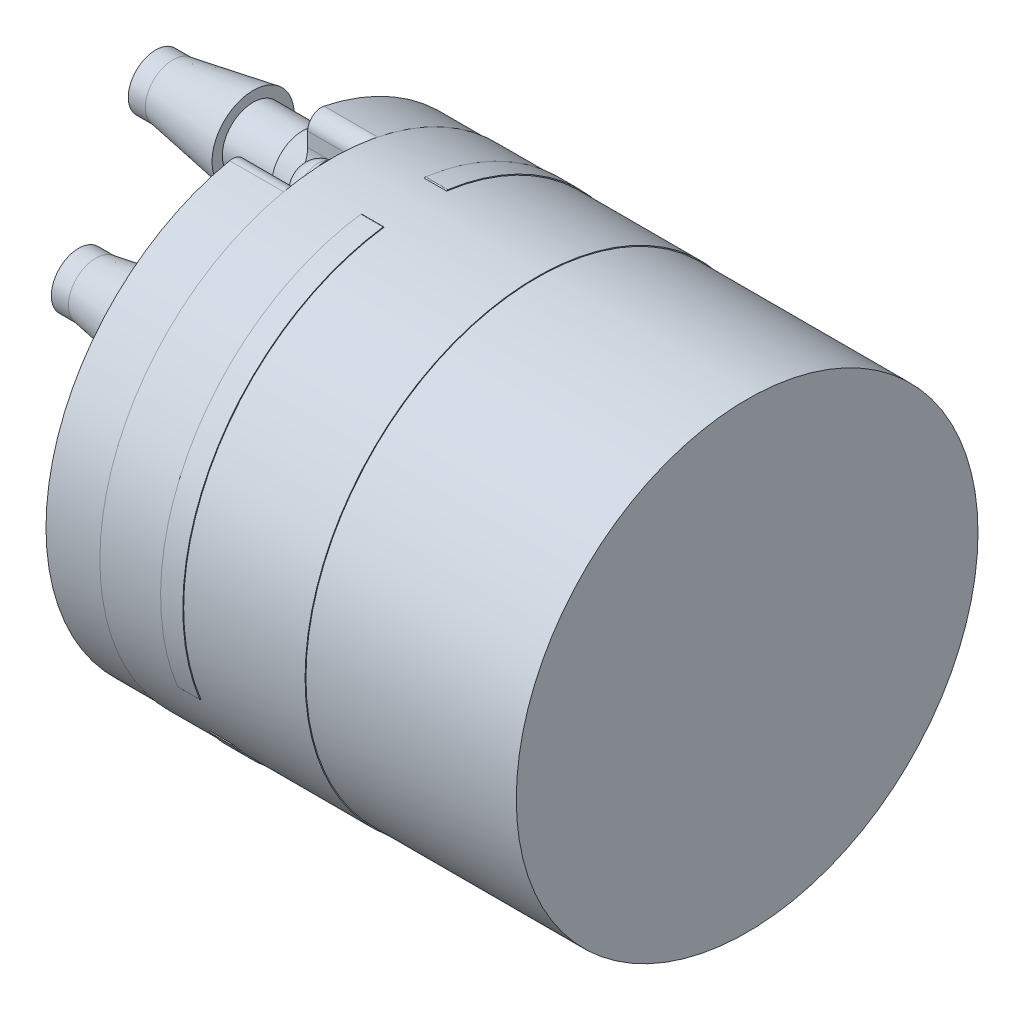
from build123d import *

# Parameters (mm, degrees)
PUMP_OD_SKETCH_R          = 13.5
PUMP_OD_EXTRUDE_DEPTH     = 27.5
PUMP_START                = 12.3
PUMP_MIDDLE_SKETCH_R      = 13.55
PUMP_MIDDLE_EXTRUDE_DEPTH = 12
DIAPHRAGM_START           = -3.6
DIAPHRAGM_EXTRUDE_DEPTH   = 1.3
SCREW_POCKET_CUT_DEPTH    = 3.2
SCREW_POCKET_FILLET_R     = 0.8
SCEW_HEAD_SKETCH_R        = 1.3
SCREW_HEAD_EXTRUDE_DEPTH  = 1.8
SCREW_HEAD_FILLET_R       = 1
SCREW_DRIVE_CUT_DEPTH     = 1
WASHER_SKETCH_R           = 1.581796131
WASHER_EXTRUDE_DEPTH      = 0.4
NOZZLE_LPATTERN_COUNT     = 2
NOZZLE_LPATTERN_PITCH     = 9


with BuildPart() as part:
    # Pump OD Sketch → Pump OD Extrude (new body)
    with BuildSketch(Plane.ZY.offset(31)):
        Circle(PUMP_OD_SKETCH_R)
    extrude(amount=PUMP_OD_EXTRUDE_DEPTH)

    # Pump Middle Sketch → Pump Middle Extrude (add)
    with BuildSketch(Plane.ZY.offset(31).offset(PUMP_START)):
        Circle(PUMP_MIDDLE_SKETCH_R)
    extrude(amount=PUMP_MIDDLE_EXTRUDE_DEPTH)

    # Diaphragm Sketch → Diaphragm Extrude (add)
    with BuildSketch(Plane.ZY.offset(55.3).offset(DIAPHRAGM_START)):
        with BuildLine():
            Line((-1.825, 12.291819434), (1.825, 12.291819434))
            Line((1.825, 12.291819434), (1.825, 13.408145845))
            ThreePointArc((1.825, 13.408145845), (1.845637465, 13.453429295), (1.893353028, 13.467561558))
            ThreePointArc((1.893353028, 13.467561558), (11.777945491, 6.8), (12.60992695, -5.094088958))
            ThreePointArc((12.60992695, -5.094088958), (12.57383027, -5.128345717), (12.524294919, -5.123576561))
            Line((12.524294919, -5.123576561), (11.557527888, -4.565413355))
            Line((11.557527888, -4.565413355), (9.732527888, -7.726406079))
            Line((9.732527888, -7.726406079), (10.699294919, -8.284569284))
            ThreePointArc((10.699294919, -8.284569284), (10.728192805, -8.325083578), (10.716573922, -8.373472599))
            ThreePointArc((10.716573922, -8.373472599), (0, -13.6), (-10.716573922, -8.373472599))
            ThreePointArc((-10.716573922, -8.373472599), (-10.728192805, -8.325083578), (-10.699294919, -8.284569284))
            Line((-10.699294919, -8.284569284), (-9.732527888, -7.726406079))
            Line((-9.732527888, -7.726406079), (-11.557527888, -4.565413355))
            Line((-11.557527888, -4.565413355), (-12.524294919, -5.123576561))
            ThreePointArc((-12.524294919, -5.123576561), (-12.57383027, -5.128345717), (-12.60992695, -5.094088958))
            ThreePointArc((-12.60992695, -5.094088958), (-11.777945491, 6.8), (-1.893353028, 13.467561558))
            ThreePointArc((-1.893353028, 13.467561558), (-1.845637465, 13.453429295), (-1.825, 13.408145845))
            Line((-1.825, 13.408145845), (-1.825, 12.291819434))
        make_face()
    extrude(amount=-DIAPHRAGM_EXTRUDE_DEPTH)

    # Screw Pocket Sketch → Screw Pocket Cut (cut)
    with BuildSketch(Plane.ZY.offset(58.5)):
        with BuildLine():
            Line((-1.8, 11.6), (-1.8, 15.537585437))
            Line((-1.8, 15.537585437), (1.8, 15.537585437))
            Line((1.8, 15.537585437), (1.8, 11.6))
            ThreePointArc((1.8, 11.6), (0, 9.8), (-1.8, 11.6))
        make_face()
    extrude(amount=-SCREW_POCKET_CUT_DEPTH, mode=Mode.SUBTRACT)

    # Screw Pocket Fillet
    screw_pocket_fillet_edges = [part.edges().sort_by_distance(p)[0] for p in [
        (-56.9, 13.379461873, -1.8),
        (-56.9, 13.379461873, 1.8),
    ]]
    fillet(screw_pocket_fillet_edges, radius=SCREW_POCKET_FILLET_R)

    # Scew Head Sketch → Screw Head Extrude (add)
    with BuildSketch(Plane.ZY.offset(55.3)):
        with Locations((0, 11.6)):
            Circle(SCEW_HEAD_SKETCH_R)
    extrude(amount=SCREW_HEAD_EXTRUDE_DEPTH)

    # Screw Head Fillet
    screw_head_fillet_edges = [part.edges().sort_by_distance(p)[0] for p in [
        (-57.1, 11.6, -1.3),
    ]]
    fillet(screw_head_fillet_edges, radius=SCREW_HEAD_FILLET_R)

    # Sketch10 → Screw Drive Cut (cut)
    with BuildSketch(Plane.ZY.offset(57.1)):
        Polygon((0.15, 11.75), (0.15, 12.4), (-0.15, 12.4), (-0.15, 11.75), (-0.8, 11.75), (-0.8, 11.45), (-0.15, 11.45), (-0.15, 10.8), (0.15, 10.8), (0.15, 11.45), (0.8, 11.45), (0.8, 11.75), align=None)
    extrude(amount=-SCREW_DRIVE_CUT_DEPTH, mode=Mode.SUBTRACT)

    # Washer Sketch → Washer Extrude (add)
    with BuildSketch(Plane.ZY.offset(55.3)):
        with Locations((0, 11.6)):
            Circle(WASHER_SKETCH_R)
    extrude(amount=WASHER_EXTRUDE_DEPTH)

    # Center Nozzle Sketch → Center Nozzle Revolve (revolve)
    with BuildSketch(Plane.XY, mode=Mode.PRIVATE) as center_nozzle_revolve_sk:
        Polygon((-70.089716671, 1.6), (-69.089716671, 1.6), (-64.389716671, 2.4), (-64.389716671, 1.8), (-61.5, 1.8), (-58.5, 2.7), (-58.5, 1), (-70.089716671, 1), align=None)
    center_nozzle_revolve = revolve(center_nozzle_revolve_sk.sketch.rotate(Axis((0, 0, 0), (-1, 0, 0)), 90), axis=Axis((0, 0, 0), (-1, 0, 0)))

    # Nozzle LPattern: Center Nozzle Revolve ×2
    with Locations(*[Vector(0, 0.8660254037844379, -0.5000000000000012) * (i * NOZZLE_LPATTERN_PITCH) for i in range(1, NOZZLE_LPATTERN_COUNT)]):
        add(center_nozzle_revolve)


solid = part.part
